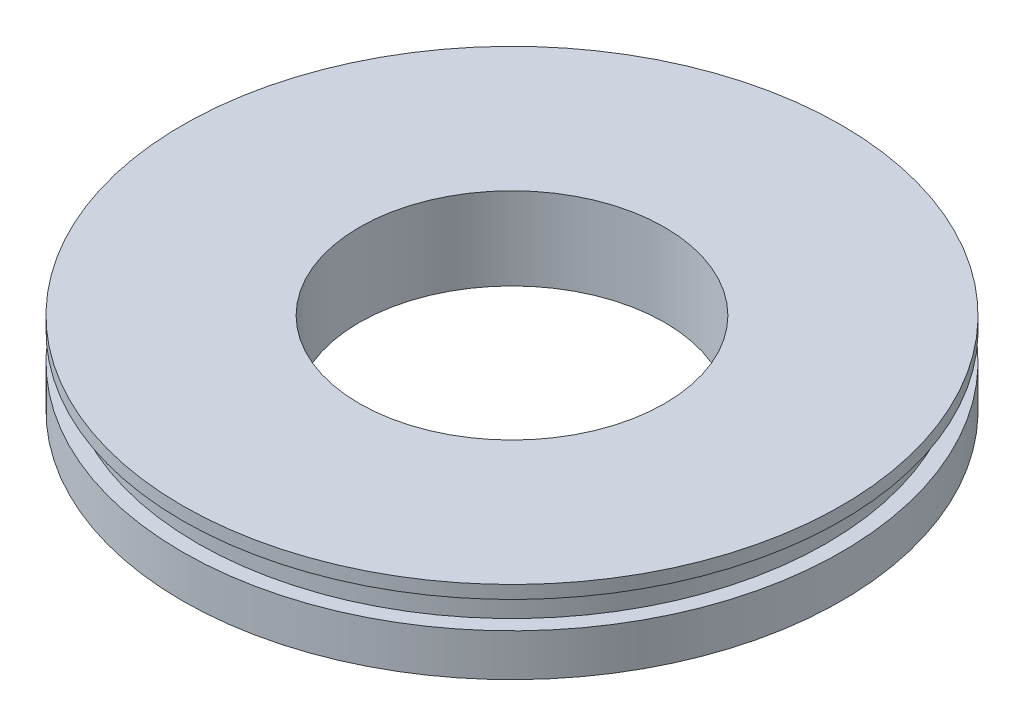
from build123d import *


with BuildPart() as part:
    # Sketch1 → Revolve1 (revolve)
    with BuildSketch(Plane(origin=(0, 0, 0), x_dir=(0, 0, -1), z_dir=(1, 0, 0))):
        Polygon((-14.2875, 2.694084), (-14.2875, -5.020818), (-30.84068, -5.020818), (-30.84068, -1.062068), (-29.43479, -1.062068), (-29.43479, 1.477932), (-30.84068, 1.477932), (-30.84068, 2.694084), align=None)
    revolve(axis=Axis((0, 0, 0), (0, -1, 0)))


solid = part.part
